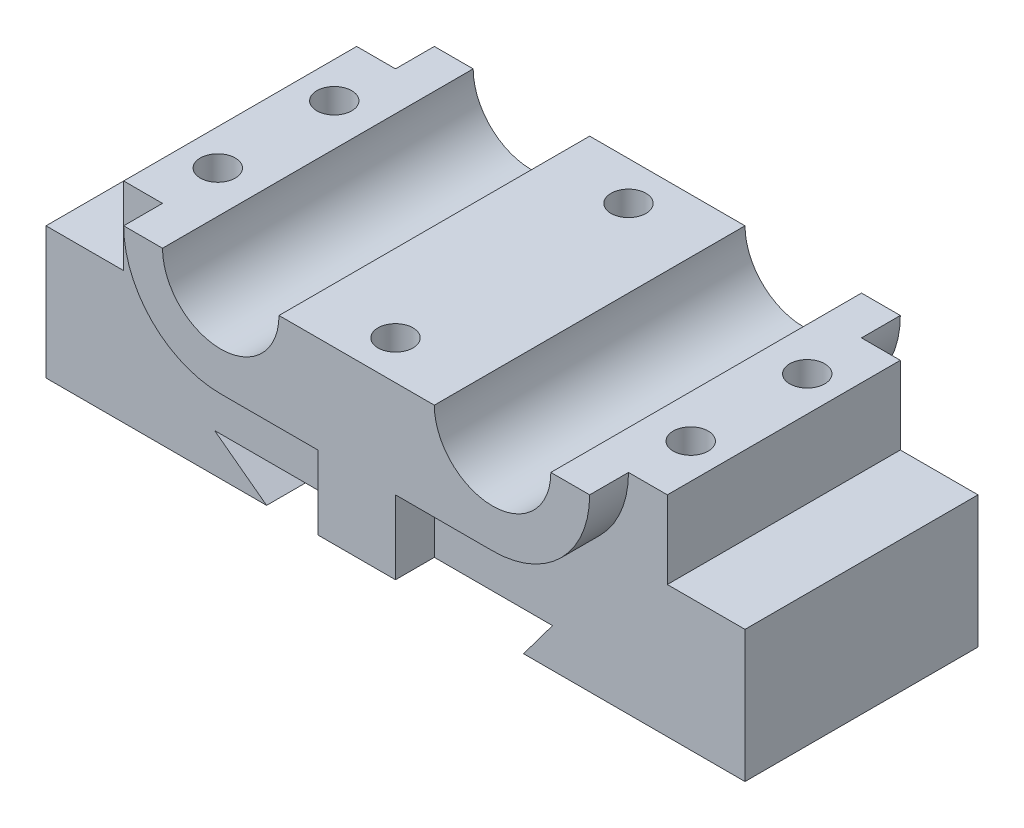
from build123d import *

# Parameters (mm, degrees)
BOSS_EXTRUDE1_DEPTH   = 15
BOSS_EXTRUDE1_2_DEPTH = 15
BOSS_EXTRUDE2_DEPTH   = 20
SKETCH2_R             = 2.25
CUT_EXTRUDE2_DEPTH    = 12.5


with BuildPart() as part:
    # Sketch1 → Boss-Extrude1 (new, symmetric)
    with BuildSketch(Plane.XY):
        with BuildLine():
            Line((0, 16.97357793), (0, 0))
            Line((0, 0), (28.405213846, 0))
            Line((28.405213846, 0), (21.707328852, 5))
            Line((21.707328852, 5), (40, 5))
            Line((40, 5), (40, 14.47357793))
            Line((40, 14.47357793), (27.5, 14.47357793))
            ThreePointArc((27.5, 14.47357793), (18.661165235, 18.134743165), (15, 26.97357793))
            Line((15, 26.97357793), (10, 26.97357793))
            Line((10, 26.97357793), (10, 16.97357793))
            Line((10, 16.97357793), (0, 16.97357793))
        make_face()
    extrude(amount=BOSS_EXTRUDE1_DEPTH, both=True)



with BuildPart() as body_2:
    # Sketch1 → Boss-Extrude1 2 (new, symmetric)
    with BuildSketch(Plane.XY):
        with BuildLine():
            Line((50, 14.47357793), (50, 5))
            Line((50, 5), (65.219288167, 5))
            Line((65.219288167, 5), (61.486766629, 0))
            Line((61.486766629, 0), (90, 0))
            Line((90, 0), (90, 16.97357793))
            Line((90, 16.97357793), (80, 16.97357793))
            Line((80, 16.97357793), (80, 26.97357793))
            Line((80, 26.97357793), (75, 26.97357793))
            ThreePointArc((75, 26.97357793), (71.338834765, 18.134743165), (62.5, 14.47357793))
            Line((62.5, 14.47357793), (50, 14.47357793))
        make_face()
    extrude(amount=BOSS_EXTRUDE1_2_DEPTH, both=True)


with BuildPart() as part_1:
    add(part.part)

    add(body_2.part)  # Boss-Extrude2 merges body 2
    # Sketch1<3> → Boss-Extrude2 (add, symmetric)
    with BuildSketch(Plane.XY):
        with BuildLine():
            Line((40, 14.47357793), (40, 5))
            Line((40, 5), (50, 5))
            Line((50, 5), (50, 14.47357793))
            Line((50, 14.47357793), (62.5, 14.47357793))
            ThreePointArc((62.5, 14.47357793), (71.338834765, 18.134743165), (75, 26.97357793))
            Line((75, 26.97357793), (70, 26.97357793))
            ThreePointArc((70, 26.97357793), (62.5, 19.47357793), (55, 26.97357793))
            Line((55, 26.97357793), (35, 26.97357793))
            ThreePointArc((35, 26.97357793), (27.5, 19.47357793), (20, 26.97357793))
            Line((20, 26.97357793), (15, 26.97357793))
            ThreePointArc((15, 26.97357793), (18.661165235, 18.134743165), (27.5, 14.47357793))
            Line((27.5, 14.47357793), (40, 14.47357793))
        make_face()
    extrude(amount=BOSS_EXTRUDE2_DEPTH, both=True)

    # Sketch2 → Cut-Extrude2 (cut)
    with BuildSketch(Plane(origin=(0, 26.97357793, 0), x_dir=(1, 0, 0), z_dir=(0, 1, 0))):
        with Locations((14.617344239, 7.5)):
            Circle(SKETCH2_R)
        with Locations((45, 15)):
            Circle(SKETCH2_R)
        with Locations((45, -15)):
            Circle(SKETCH2_R)
        with Locations((14.617344239, -7.5)):
            Circle(SKETCH2_R)
        with Locations((75.511403754, 7.5)):
            Circle(SKETCH2_R)
        with Locations((75.511403754, -7.5)):
            Circle(SKETCH2_R)
    extrude(amount=-CUT_EXTRUDE2_DEPTH, mode=Mode.SUBTRACT)


solid = part_1.part
